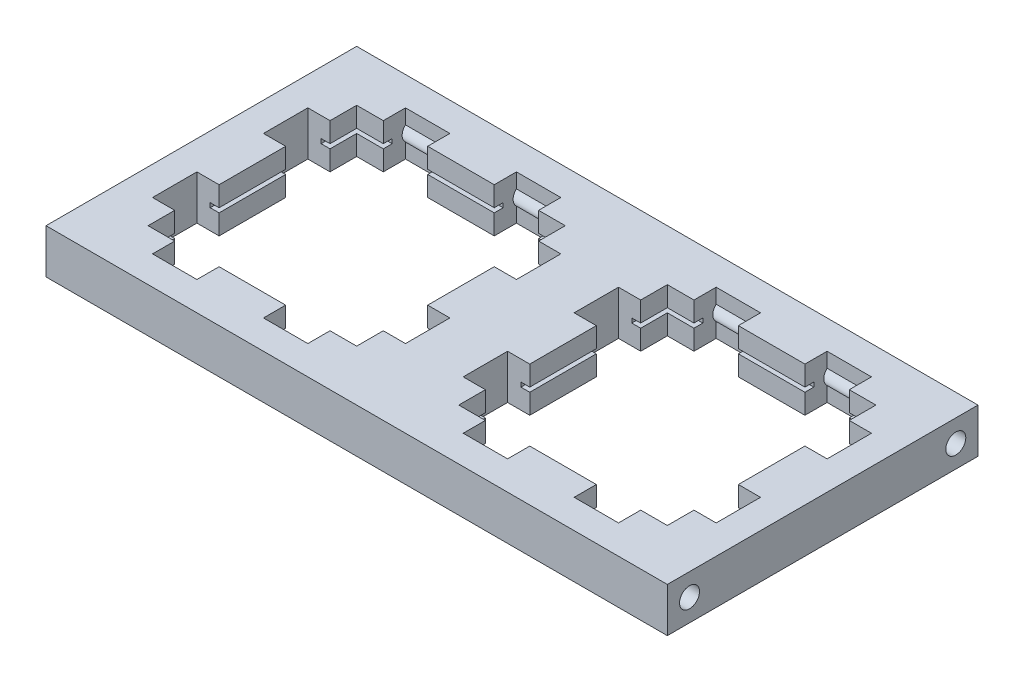
from build123d import *

# Parameters (mm, degrees)
SKETCH1_W           = 140
SKETCH1_H           = 70
BOSS_EXTRUDE1_DEPTH = 5
SKETCH2_R           = 2.25
CUT_EXTRUDE1_DEPTH  = 145.395290782
SKETCH3_W           = 51
SKETCH3_H           = 51
CUT_EXTRUDE2_DEPTH  = 0.5
SKETCH4_W           = 47
SKETCH4_H           = 47
CUT_EXTRUDE3_DEPTH  = 79.89866919
SKETCH5_W           = 10
SKETCH5_H           = 5
SKETCH5_W_2         = 5
SKETCH5_H_2         = 10
CUT_EXTRUDE4_DEPTH  = 79.89866919


with BuildPart() as part:
    # Sketch1 → Boss-Extrude1 (new, symmetric)
    with BuildSketch(Plane(origin=(0, 0, 0), x_dir=(1, 0, 0), z_dir=(0, 1, 0))):
        Rectangle(SKETCH1_W, SKETCH1_H)
    extrude(amount=BOSS_EXTRUDE1_DEPTH, both=True)

    # Sketch2 → Cut-Extrude1 (cut, through all)
    with BuildSketch(Plane(origin=(70, 0, 0), x_dir=(0, 0, -1), z_dir=(1, 0, 0))):
        with Locations((-30, 0)):
            Circle(SKETCH2_R)
        with Locations((30, 0)):
            Circle(SKETCH2_R)
    extrude(amount=-CUT_EXTRUDE1_DEPTH, mode=Mode.SUBTRACT)

    # Sketch3 → Cut-Extrude2 (cut, symmetric)
    with BuildSketch(Plane(origin=(0, 0, 0), x_dir=(1, 0, 0), z_dir=(0, 1, 0))):
        with Locations((-35, 0)):
            Rectangle(SKETCH3_W, SKETCH3_H)
    cut_extrude2 = extrude(amount=CUT_EXTRUDE2_DEPTH, both=True, mode=Mode.SUBTRACT)

    # Sketch4 → Cut-Extrude3 (cut, through all)
    with BuildSketch(Plane(origin=(0, 5, 0), x_dir=(1, 0, 0), z_dir=(0, 1, 0))):
        with Locations((-35, 0)):
            Rectangle(SKETCH4_W, SKETCH4_H)
    cut_extrude3 = extrude(amount=-CUT_EXTRUDE3_DEPTH, mode=Mode.SUBTRACT)

    # Sketch5 → Cut-Extrude4 (cut, through all)
    with BuildSketch(Plane(origin=(0, 5, 0), x_dir=(1, 0, 0), z_dir=(0, 1, 0))):
        with Locations((-47.5, 26)):
            Rectangle(SKETCH5_W, SKETCH5_H)
        with Locations((-22.5, 26)):
            Rectangle(SKETCH5_W, SKETCH5_H)
        with Locations((-9, 12.5)):
            Rectangle(SKETCH5_W_2, SKETCH5_H_2)
        with Locations((-9, -12.5)):
            Rectangle(SKETCH5_W_2, SKETCH5_H_2)
        with Locations((-22.5, -26)):
            Rectangle(SKETCH5_W, SKETCH5_H)
        with Locations((-47.5, -26)):
            Rectangle(SKETCH5_W, SKETCH5_H)
        with Locations((-61, -12.5)):
            Rectangle(SKETCH5_W_2, SKETCH5_H_2)
        with Locations((-61, 12.5)):
            Rectangle(SKETCH5_W_2, SKETCH5_H_2)
    cut_extrude4 = extrude(amount=-CUT_EXTRUDE4_DEPTH, mode=Mode.SUBTRACT)

    # Mirror1: Cut-Extrude2, Cut-Extrude3, Cut-Extrude4 across plane
    add(cut_extrude2.mirror(Plane(origin=(0, 0, 0), x_dir=(0, 0, 1), z_dir=(1, 0, 0))), mode=Mode.SUBTRACT)
    add(cut_extrude3.mirror(Plane(origin=(0, 0, 0), x_dir=(0, 0, 1), z_dir=(1, 0, 0))), mode=Mode.SUBTRACT)
    add(cut_extrude4.mirror(Plane(origin=(0, 0, 0), x_dir=(0, 0, 1), z_dir=(1, 0, 0))), mode=Mode.SUBTRACT)


solid = part.part
